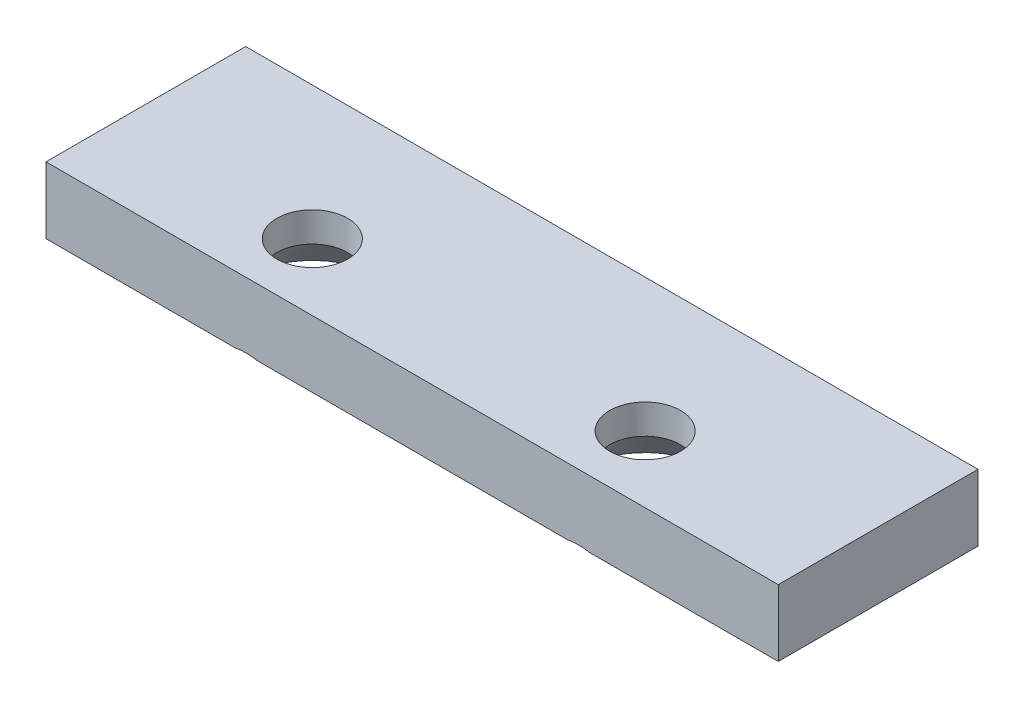
from build123d import *

# Parameters (mm, degrees)
SKETCH1_W                                        = 69.85
SKETCH1_H                                        = 19.05
BOSS_EXTRUDE1_DEPTH                              = 6.35
CSK_FOR_1_4_FLAT_HEAD_MACHINE_SCREW1_D           = 6.7564
CSK_FOR_1_4_FLAT_HEAD_MACHINE_SCREW1_DEPTH       = 15.24
CSK_FOR_1_4_FLAT_HEAD_MACHINE_SCREW1_CSINK_D     = 12.8778
CSK_FOR_1_4_FLAT_HEAD_MACHINE_SCREW1_CSINK_ANGLE = 82
CSK_FOR_1_4_FLAT_HEAD_MACHINE_SCREW1_TIP         = 2.029827343


with BuildPart() as part:
    # Sketch1 → Boss-Extrude1 (new body)
    with BuildSketch(Plane(origin=(0, 0, 0), x_dir=(1, 0, 0), z_dir=(0, 1, 0))):
        Rectangle(SKETCH1_W, SKETCH1_H)
    extrude(amount=BOSS_EXTRUDE1_DEPTH)

    # CSK for 1/4 Flat Head Machine Screw1
    with Locations(Plane(origin=(0, 0, 0), x_dir=(-1, 0, 0), z_dir=(0, -1, 0))):
        with Locations((15.875, -3.175), (-15.875, -3.175)):
            CounterSinkHole(CSK_FOR_1_4_FLAT_HEAD_MACHINE_SCREW1_D / 2, CSK_FOR_1_4_FLAT_HEAD_MACHINE_SCREW1_CSINK_D / 2, depth=CSK_FOR_1_4_FLAT_HEAD_MACHINE_SCREW1_DEPTH, counter_sink_angle=CSK_FOR_1_4_FLAT_HEAD_MACHINE_SCREW1_CSINK_ANGLE)
            with Locations((0, 0, -(CSK_FOR_1_4_FLAT_HEAD_MACHINE_SCREW1_DEPTH + CSK_FOR_1_4_FLAT_HEAD_MACHINE_SCREW1_TIP / 2))):  # 118° drill point
                Cone(0, CSK_FOR_1_4_FLAT_HEAD_MACHINE_SCREW1_D / 2, CSK_FOR_1_4_FLAT_HEAD_MACHINE_SCREW1_TIP, mode=Mode.SUBTRACT)


solid = part.part
